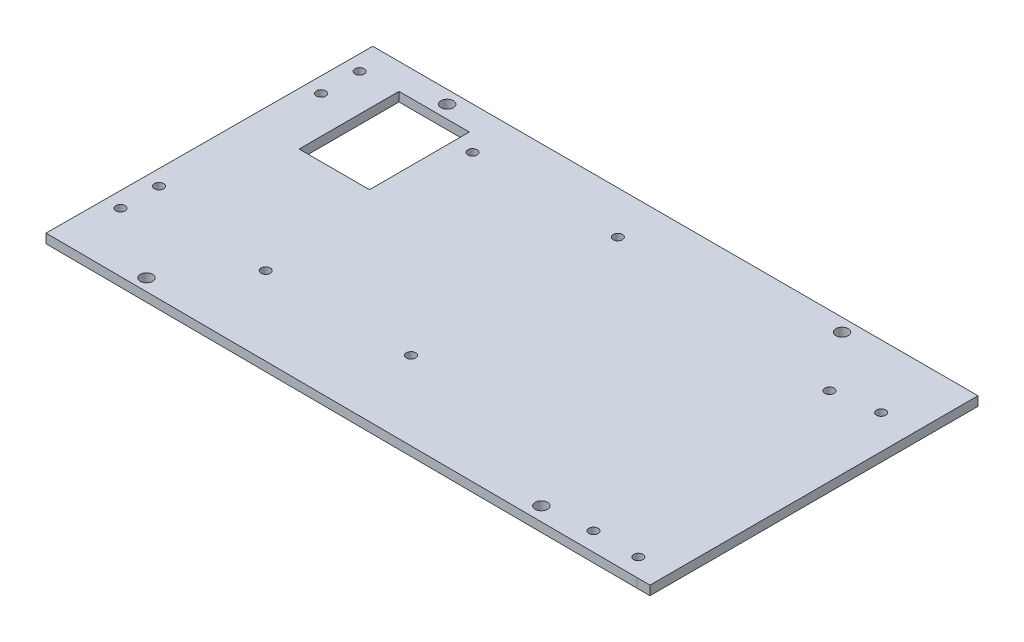
from build123d import *

# Parameters (mm, degrees)
SKETCH1_R               = 1.5
BOSS_EXTRUDE1_DEPTH     = 3
CUT_EXTRUDE1_DEPTH      = 117.441839515
CUT_EXTRUDE1_DEPTH_BACK = 117.441839515
BOSS_EXTRUDE4_DEPTH     = 3
SKETCH5_W               = 197.044523164
SKETCH5_H               = 3
BOSS_EXTRUDE5_DEPTH     = 3
CUT_EXTRUDE3_DEPTH      = 117.441839515
CUT_EXTRUDE3_DEPTH_BACK = 117.441839515
SKETCH6_R               = 2


with BuildPart() as part:
    # Sketch1 → Boss-Extrude1 (new body)
    with BuildSketch(Plane(origin=(0, 0, 0), x_dir=(1, 0, 0), z_dir=(0, 1, 0))):
        Polygon((-84.458557919, 26.833968268), (-84.458557919, 48.772574994), (-94.458442431, 48.8206348), (-94.578591945, 23.820923519), (-94.881368721, -39.178348907), (-94.952977831, -54.07817683), (98.36173931, -55.007254334), (102.586080733, -55.007254334), (102.586080733, 22.87334299), (102.586080733, 48.772574994), (-62.665629197, 48.772574994), (-62.665629197, 26.833968268), align=None)
        with Locations(Location((-89.851389086, -34.95245099, 0), (0, 0, 270))):
            Circle(SKETCH1_R, mode=Mode.SUBTRACT)
        with Locations(Location((-1.069960941, -29.129088653, 0), (0, 0, 270))):
            Circle(SKETCH1_R, mode=Mode.SUBTRACT)
        with Locations(Location((-89.791314329, -22.452595349, 0), (0, 0, 270))):
            Circle(SKETCH1_R, mode=Mode.SUBTRACT)
        with Locations(Location((-48.61901855, -28.900566167, 0), (0, 0, 270))):
            Circle(SKETCH1_R, mode=Mode.SUBTRACT)
        with Locations(Location((78.109513121, -48.909852111, 0), (0, 0, 270))):
            Circle(SKETCH1_R, mode=Mode.SUBTRACT)
        with Locations(Location((92.757382127, -48.980250297, 0), (0, 0, 270))):
            Circle(SKETCH1_R, mode=Mode.SUBTRACT)
        with Locations(Location((-89.548612311, 30.046821437, 0), (0, 0, 270))):
            Circle(SKETCH1_R, mode=Mode.SUBTRACT)
        with Locations(Location((-89.488537553, 42.546677077, 0), (0, 0, 270))):
            Circle(SKETCH1_R, mode=Mode.SUBTRACT)
        with Locations(Location((-48.297017852, 38.098660064, 0), (0, 0, 270))):
            Circle(SKETCH1_R, mode=Mode.SUBTRACT)
        with Locations(Location((-0.747960243, 37.870137578, 0), (0, 0, 270))):
            Circle(SKETCH1_R, mode=Mode.SUBTRACT)
        with Locations(Location((77.015212266, 28.9963068, 0), (0, 0, 270))):
            Circle(SKETCH1_R, mode=Mode.SUBTRACT)
        with Locations(Location((91.576164691, 31.240232702, 0), (0, 0, 270))):
            Circle(SKETCH1_R, mode=Mode.SUBTRACT)
    extrude(amount=BOSS_EXTRUDE1_DEPTH)

    # Sketch3 → Cut-Extrude1 (cut, two sides: drawn at the far end of the back side and taken through both)
    with BuildSketch(Plane(origin=(0, 3, 0), x_dir=(1, 0, 0), z_dir=(0, 1, 0)).offset(-CUT_EXTRUDE1_DEPTH_BACK)):
        Polygon((-62.665629197, 26.833968268), (-77.458442431, 26.833968268), (-77.458442431, 10.8206348), (-54.548666479, 10.8206348), (-54.548666479, 48.772574994), (-62.665629197, 48.772574994), align=None)
    extrude(amount=CUT_EXTRUDE1_DEPTH + CUT_EXTRUDE1_DEPTH_BACK, mode=Mode.SUBTRACT)

    # Sketch4 → Boss-Extrude4 (add)
    with BuildSketch(Plane.XZ):
        Polygon((-77.458442431, -26.833968268), (-84.458557919, -26.833968268), (-84.458557919, -48.772574994), (-54.548666479, -48.772574994), (-54.548666479, -43.333568131), (-77.458442431, -43.333568131), align=None)
    extrude(amount=-BOSS_EXTRUDE4_DEPTH)

    # Sketch5 → Boss-Extrude5 (add)
    with BuildSketch(Plane.XZ):
        with Locations((4.063819151, -50.272574994)):
            Rectangle(SKETCH5_W, SKETCH5_H)
    extrude(amount=-BOSS_EXTRUDE5_DEPTH)

    # Sketch6 → Cut-Extrude3 (cut, two sides: drawn at the far end of the back side and taken through both)
    with BuildSketch(Plane.XZ.offset(-CUT_EXTRUDE3_DEPTH_BACK)):
        with Locations(Location((-66.003554455, -47.553071563, 0), (0, 0, 270))):
            Circle(SKETCH6_R)
        with Locations(Location((62.548576351, -47.553071563, 0), (0, 0, 90))):
            Circle(SKETCH6_R)
        with Locations(Location((62.548576351, 50.323212151, 0), (0, 0, 270))):
            Circle(SKETCH6_R)
        with Locations(Location((-66.003554455, 50.323212151, 0), (0, 0, 90))):
            Circle(SKETCH6_R)
    extrude(amount=CUT_EXTRUDE3_DEPTH + CUT_EXTRUDE3_DEPTH_BACK, mode=Mode.SUBTRACT)


solid = part.part
